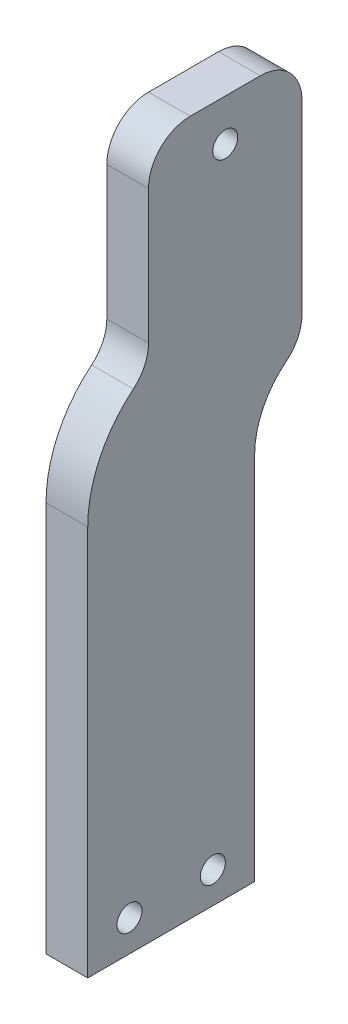
from build123d import *

# Parameters (mm, degrees)
EXTRUDE_1_DEPTH     = 10
SKETCH_2_R          = 3
CUT_EXTRUDE_1_DEPTH = 25


with BuildPart() as part:
    # Эскиз1 → Вытянуть1 (new body)
    with BuildSketch(Plane(origin=(0, 0, 0), x_dir=(0, 0, -1), z_dir=(1, 0, 0))):
        with BuildLine():
            Line((-19.99990009, 63.483695787), (-19.99990009, -30.143863535))
            Line((-19.99990009, -30.143863535), (20.00009991, -30.143863535))
            Line((20.00009991, -30.143863535), (20.00009991, 58.395614664))
            ThreePointArc((20.00009991, 58.395614664), (21.991555525, 67.095748523), (27.569332826, 74.063289338))
            ThreePointArc((27.569332826, 74.063289338), (30.358221476, 77.547059746), (31.353949284, 81.897126676))
            Line((31.353949284, 81.897126676), (31.353949284, 126.453197444))
            ThreePointArc((31.353949284, 126.453197444), (28.425017096, 133.524265256), (21.353949284, 136.453197444))
            Line((21.353949284, 136.453197444), (4.569303476, 136.453197444))
            ThreePointArc((4.569303476, 136.453197444), (-2.501764335, 133.524265256), (-5.430696524, 126.453197444))
            Line((-5.430696524, 126.453197444), (-5.430696524, 94.358841013))
            ThreePointArc((-5.430696524, 94.358841013), (-6.386997306, 90.091347082), (-9.072997415, 86.640054707))
            ThreePointArc((-9.072997415, 86.640054707), (-17.130997744, 76.286177582), (-19.99990009, 63.483695787))
        make_face()
    extrude(amount=EXTRUDE_1_DEPTH)

    # Эскиз2 → Вырез-Вытянуть1 (cut)
    with BuildSketch(Plane.ZY):
        with Locations((10, -22.643863535)):
            Circle(SKETCH_2_R)
        with Locations((-10, -22.643863535)):
            Circle(SKETCH_2_R)
        with Locations((-12.96162638, 126.453197444)):
            Circle(SKETCH_2_R)
    extrude(amount=-CUT_EXTRUDE_1_DEPTH, mode=Mode.SUBTRACT)


solid = part.part
